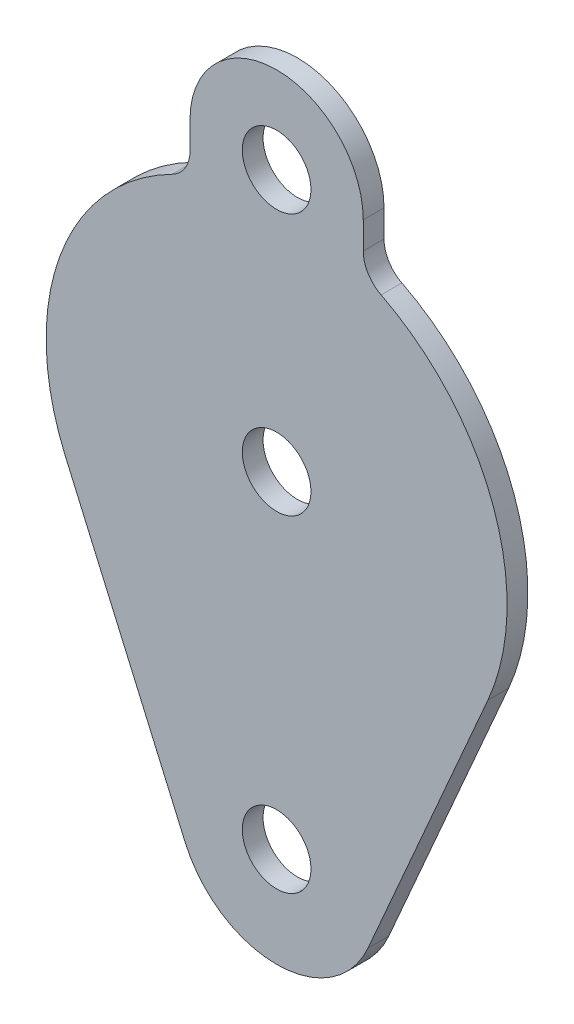
from build123d import *

# Parameters (mm, degrees)
ESBO_O1_R       = 5.25
EXTRUS_O1_DEPTH = 3.175
FILETE1_R       = 5


with BuildPart() as part:
    # Esboço1 → Extrusão1 (new body)
    with BuildSketch(Plane.XY):
        with BuildLine():
            ThreePointArc((-13.25, 32.664965942), (-32.643593337, 13.30256795), (-32.307158649, -14.1))
            Line((-32.307158649, -14.1), (-13.97685587, -56.1))
            ThreePointArc((-13.97685587, -56.1), (0, -65.25), (13.97685587, -56.1))
            Line((13.97685587, -56.1), (32.307158649, -14.1))
            ThreePointArc((32.307158649, -14.1), (32.643593337, 13.30256795), (13.25, 32.664965942))
            Line((13.25, 32.664965942), (13.25, 40))
            ThreePointArc((13.25, 40), (0, 53.25), (-13.25, 40))
            Line((-13.25, 40), (-13.25, 32.664965942))
        make_face()
        with Locations((0, 40)):
            Circle(ESBO_O1_R, mode=Mode.SUBTRACT)
        with Locations((0, -50)):
            Circle(ESBO_O1_R, mode=Mode.SUBTRACT)
        Circle(ESBO_O1_R, mode=Mode.SUBTRACT)
    extrude(amount=EXTRUS_O1_DEPTH)

    # Filete1
    filete1_edges = [part.edges().sort_by_distance(p)[0] for p in [
        (13.25, 32.664965942, 1.5875),
        (-13.25, 32.664965942, 1.5875),
    ]]
    fillet(filete1_edges, radius=FILETE1_R)


solid = part.part
